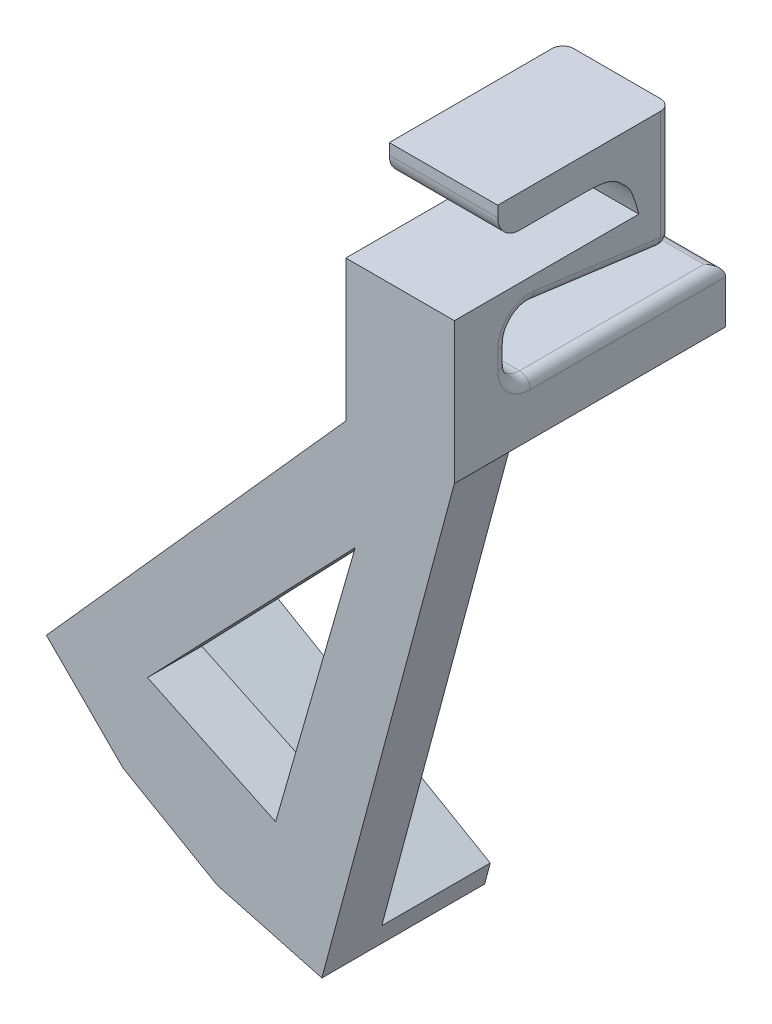
from build123d import *

# Parameters (mm, degrees)
BOSS_EXTRUDE1_DEPTH = 10
BOSS_EXTRUDE2_DEPTH = 5
BOSS_EXTRUDE3_DEPTH = 10
FILLET1_R           = 2
FILLET2_R           = 1


with BuildPart() as part:
    # Sketch2 → Boss-Extrude1 (new body)
    with BuildSketch(Plane(origin=(0, 0, 0), x_dir=(0, 0, -1), z_dir=(1, 0, 0))):
        with BuildLine():
            Line((17, 13), (20, 13))
            Line((20, 13), (20, 20.212962963))
            Line((20, 20.212962963), (4, 20.212962963))
            Line((4, 20.212962963), (4, 19.212962963))
            ThreePointArc((4, 19.212962963), (4.585786438, 17.798749401), (6, 17.212962963))
            Line((6, 17.212962963), (12.34969837, 17.212962963))
            add(Edge.make_bspline(
                [(12.34969837, 17.212962963), (14.53461085, 17.212962963), (15.619631597, 15.872704948), (16.340899905, 15.502936293), (17, 13)],
                knots=[0, 0, 0, 0, 0.495488683, 1, 1, 1, 1], degree=3))
        make_face()
        Polygon((20, 11), (20, 13), (17, 13), (5, 13), (5, 11), align=None)
        with BuildLine():
            Line((20, 10.142183063), (20, 11))
            Line((20, 11), (5, 11))
            Line((5, 11), (18.86783628, 9.150955163))
            ThreePointArc((18.86783628, 9.150955163), (19.658724631, 9.389798946), (20, 10.142183063))
        make_face()
        Polygon((5, 11), (5, 13), (0, 13), (0, 0), (5, 0), (5, 3), (5, 5), align=None)
        Polygon((25, 5), (5, 5), (5, 3), (5, 0), (25, 0), align=None)
    extrude(amount=BOSS_EXTRUDE1_DEPTH)

    # Sketch4 → Boss-Extrude2 (add)
    with BuildSketch(Plane.XY):
        Polygon((10, 0), (-2.208590345, -45.563079458), (-11.867848608, -42.974889007), (-20.528102646, -37.974889007), (-27.599170458, -30.903821195), (0, 0), align=None)
        Polygon((-18.277381589, -29.621786509), (-6.470899787, -35.226395597), (0.864887029, -9.676755979), align=None, mode=Mode.SUBTRACT)
    extrude(amount=-BOSS_EXTRUDE2_DEPTH)

    # Sketch5 → Boss-Extrude3 (add)
    with BuildSketch(Plane(origin=(0, 0, -5), x_dir=(-1, 0, 0), z_dir=(0, 0, -1))):
        Polygon((2.208590345, -45.563079458), (11.867848608, -42.974889007), (20.528102646, -37.974889007), (27.599170458, -30.903821195), (26.266965075, -29.412101108), (1.690952255, -43.631227805), align=None)
    extrude(amount=BOSS_EXTRUDE3_DEPTH)

    # Fillet1
    fillet1_edges = [part.edges().sort_by_distance(p)[0] for p in [
        (5, 11, -5),
        (5, 5, -5),
    ]]
    fillet(fillet1_edges, radius=FILLET1_R)

    # Fillet2
    fillet2_edges = [part.edges().sort_by_distance(p)[0] for p in [
        (0, 15.177573013, -20),
        (0, 9.389798946, -19.658724631),
        (0, 9.924522419, -13.06608186),
        (10, 9.924522419, -13.06608186),
        (10, 9.389798946, -19.658724631),
        (5, 5, -25),
        (10, 15.177573013, -20),
        (0, 7.857816937, -5),
        (10, 7.857816937, -5),
        (0, 5, -16),
        (10, 5, -16),
        (0, 5.585786438, -5.585786438),
        (10, 5.585786438, -5.585786438),
        (0, 10.220402108, -5.682550737),
        (10, 10.220402108, -5.682550737),
    ]]
    fillet(fillet2_edges, radius=FILLET2_R)


solid = part.part
